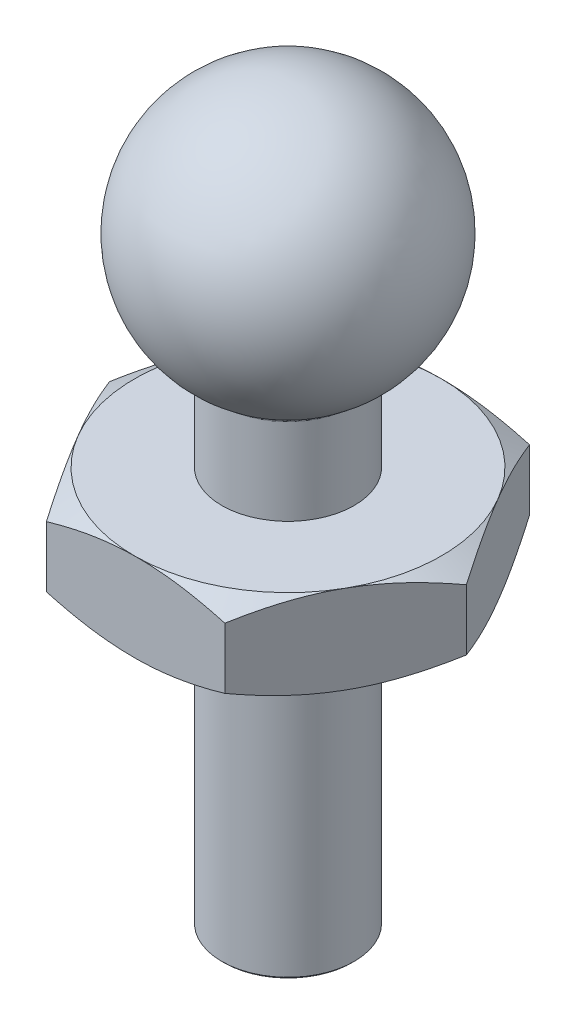
from build123d import *

# Parameters (mm, degrees)
CHAMFER1_SIZE       = 0.05
BOSS_EXTRUDE1_START = -2
SKETCH4_R           = 1.5
BOSS_EXTRUDE1_DEPTH = 2
SKETCH5_OUTSIDE_W   = 20.904
SKETCH5_OUTSIDE_H   = 19.856
SKETCH5_OUTSIDE_R   = 3.478175124
CUT_EXTRUDE2_DEPTH  = 2
CUT_EXTRUDE2_DRAFT  = -60
SKETCH6_OUTSIDE_W   = 20.904
SKETCH6_OUTSIDE_H   = 19.856
SKETCH6_OUTSIDE_R   = 3.478175124
CUT_EXTRUDE3_DEPTH  = 2
CUT_EXTRUDE3_DRAFT  = -60
FILLET1_R           = 0.075


with BuildPart() as part:
    # Sketch1 → Revolve1 (revolve)
    with BuildSketch(Plane.XY):
        with BuildLine():
            Line((0, 16.598076211), (0, 0))
            Line((0, 0), (1.5, 0))
            Line((1.5, 0), (1.5, 11))
            ThreePointArc((1.5, 11), (2.897777479, 14.374533347), (0, 16.598076211))
        make_face()
    revolve(axis=Axis((0, 16.598076211, 0), (0, -1, 0)))

    # Chamfer1
    chamfer1_edges = [part.edges().sort_by_distance(p)[0] for p in [
        (-1.5, 0, 0),
    ]]
    chamfer(chamfer1_edges, length=CHAMFER1_SIZE)

    # Sketch4 → Boss-Extrude1 (add)
    with BuildSketch(Plane(origin=(0, 7, 0), x_dir=(-1, 0, 0), z_dir=(0, -1, 0)).offset(BOSS_EXTRUDE1_START)):
        Polygon((1.983846765, -3.492079839), (4.016153235, -0.027978224), (2.032306471, 3.464101615), (-1.983846765, 3.492079839), (-4.016153235, 0.027978224), (-2.032306471, -3.464101615), align=None)
        with Locations(Location((0, 0, 0), (0, 0, 270))):
            Circle(SKETCH4_R, mode=Mode.SUBTRACT)
    extrude(amount=BOSS_EXTRUDE1_DEPTH)


with BuildPart() as cut_extrude2_tool:
    # Sketch5 outside → Cut-Extrude2 (with draft: the straight prism first)
    with BuildSketch(Plane.XZ.offset(-7)):
        Rectangle(SKETCH5_OUTSIDE_W, SKETCH5_OUTSIDE_H)
        Circle(SKETCH5_OUTSIDE_R, mode=Mode.SUBTRACT)
    extrude(amount=-CUT_EXTRUDE2_DEPTH)
    # Cut-Extrude2: the draft: its side faces are tilted about the plane it starts from
    cut_extrude2_sides = [cut_extrude2_tool.faces().sort_by_distance(p)[0] for p in [
        (0, 8, -9.928),
        (10.452, 8, 0),
        (0, 8, 9.928),
        (-10.452, 8, 0),
        (-3.478175124, 8, 0),
    ]]
    draft(cut_extrude2_sides, Plane.XZ.offset(-7), CUT_EXTRUDE2_DRAFT)


with BuildPart() as part_1:
    add(part.part)

    # Cut-Extrude2: cut by cut_extrude2_tool
    add(cut_extrude2_tool.part, mode=Mode.SUBTRACT)


with BuildPart() as cut_extrude3_tool:
    # Sketch6 outside → Cut-Extrude3 (with draft: the straight prism first)
    with BuildSketch(Plane(origin=(0, 9, 0), x_dir=(1, 0, 0), z_dir=(0, 1, 0))):
        Rectangle(SKETCH6_OUTSIDE_W, SKETCH6_OUTSIDE_H)
        Circle(SKETCH6_OUTSIDE_R, mode=Mode.SUBTRACT)
    extrude(amount=-CUT_EXTRUDE3_DEPTH)
    # Cut-Extrude3: the draft: its side faces are tilted about the plane it starts from
    cut_extrude3_sides = [cut_extrude3_tool.faces().sort_by_distance(p)[0] for p in [
        (0, 8, 9.928),
        (10.452, 8, 0),
        (0, 8, -9.928),
        (-10.452, 8, 0),
        (-3.478175124, 8, 0),
    ]]
    draft(cut_extrude3_sides, Plane(origin=(0, 9, 0), x_dir=(1, 0, 0), z_dir=(0, 1, 0)), CUT_EXTRUDE3_DRAFT)


with BuildPart() as part_2:
    add(part_1.part)

    # Cut-Extrude3: cut by cut_extrude3_tool
    add(cut_extrude3_tool.part, mode=Mode.SUBTRACT)

    # Fillet1
    fillet1_edges = [part_2.edges().sort_by_distance(p)[0] for p in [
        (-1.5, 11, 0),
    ]]
    fillet(fillet1_edges, radius=FILLET1_R)


solid = part_2.part
